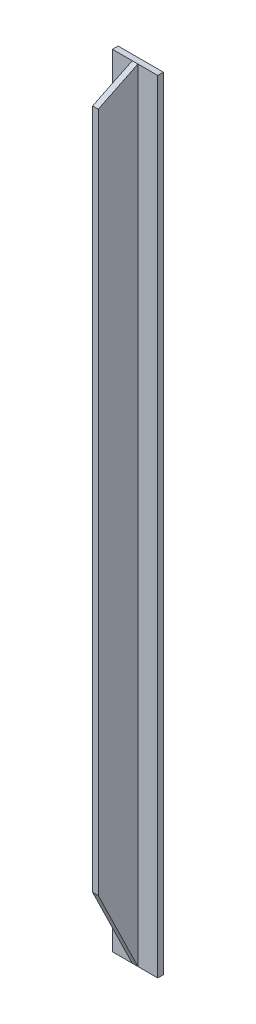
from build123d import *

# Parameters (mm, degrees)
BOSS_EXTRUDE1_DEPTH = 438.15
CUT_EXTRUDE1_DEPTH  = 438.15


with BuildPart() as part:
    # Sketch2 → Boss-Extrude1 (new body)
    with BuildSketch(Plane(origin=(0, 0, 0), x_dir=(1, 0, 0), z_dir=(0, 1, 0))):
        Polygon((0, 0), (3.175, 0), (3.175, 22.225), (14.2875, 22.225), (14.2875, 25.4), (-11.1125, 25.4), (-11.1125, 22.225), (0, 22.225), align=None)
    extrude(amount=BOSS_EXTRUDE1_DEPTH)

    # Sketch4 → Cut-Extrude1 (cut)
    with BuildSketch(Plane(origin=(3.175, 0, 0), x_dir=(0, 0, -1), z_dir=(1, 0, 0))):
        Polygon((22.225, 0), (0, 45.568002879), (0, 0), align=None)
        Polygon((22.225, 438.15), (0, 427.310143219), (0, 438.15), align=None)
    extrude(amount=-CUT_EXTRUDE1_DEPTH, mode=Mode.SUBTRACT)


solid = part.part
